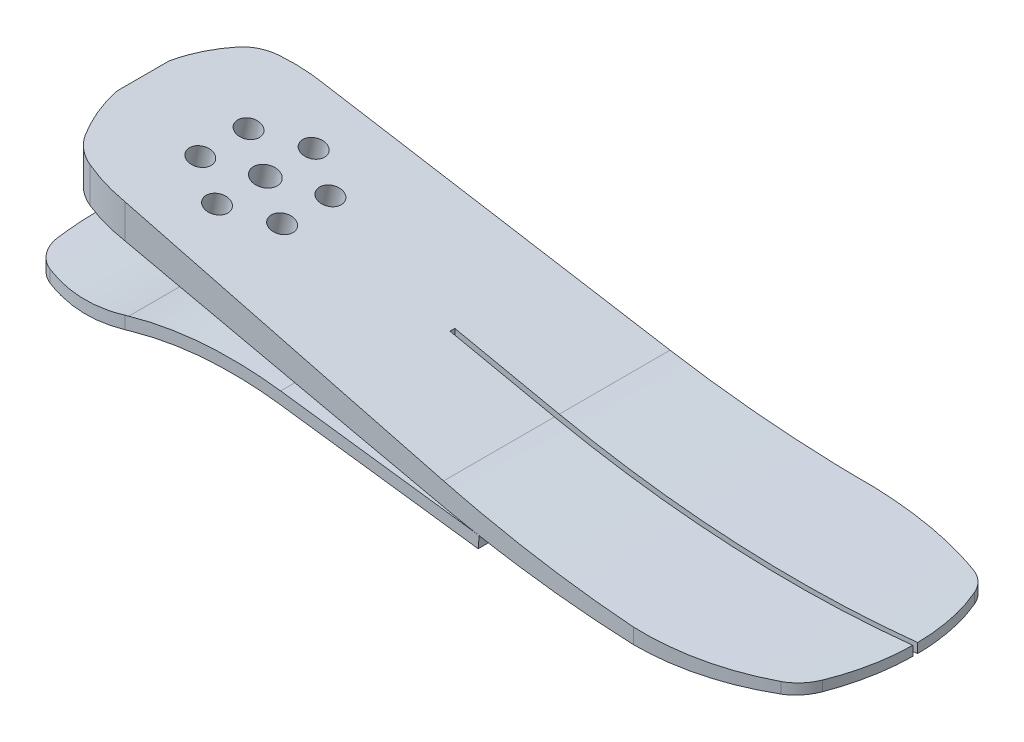
from build123d import *

# Parameters (mm, degrees)
EXTRUDE_1_DEPTH          = 80
CUT_EXTRUDE_1_DEPTH      = 80
CUT_EXTRUDE_1_DEPTH_BACK = 80
SKETCH_2_OUTSIDE_W       = 249.571
SKETCH_2_OUTSIDE_H       = 126.166
EXTRUDE_2_DEPTH          = 80
SKETCH_3_R               = 3
SKETCH_3_R_2             = 2.75
CUT_EXTRUDE_2_DEPTH      = 9
CUT_EXTRUDE_3_DEPTH      = 16
CUT_EXTRUDE_3_DEPTH_BACK = 8
SKETCH_4_W               = 130
SKETCH_4_H               = 1.2
CUT_EXTRUDE_4_DEPTH      = 80
CUT_EXTRUDE_4_DEPTH_BACK = 80
SKETCH_6_OUTSIDE_W       = 274.986
SKETCH_6_OUTSIDE_H       = 130.25
CUT_EXTRUDE_5_DEPTH      = 4
CUT_EXTRUDE_5_DEPTH_BACK = 10
SKETCH_7_W               = 148.853321433
SKETCH_7_H               = 1.2
EXTRUDE_START            = 25
EXTRUDE_3_DEPTH          = 30


with BuildPart() as part:
    # 草图1 → 凸台-拉伸1 (new body)
    with BuildSketch(Plane.XY):
        with BuildLine():
            Line((-103.404814066, 18.233058655), (0, 0))
            ThreePointArc((0, 0), (50, -4.374433176), (100, 0))
            Line((100, 0), (99.652703645, 1.969615506))
            ThreePointArc((99.652703645, 1.969615506), (50.154483855, -0.584955192), (0.955064977, 5.416442642))
            Line((0.955064977, 5.416442642), (-101.841980467, 27.096328432))
            Line((-101.841980467, 27.096328432), (-103.404814066, 18.233058655))
        make_face()
    extrude(amount=EXTRUDE_1_DEPTH)

    # 草图2 outside → 切除-拉伸1 (cut, two sides: drawn at the far end of the back side and taken through both)
    with BuildSketch(Plane(origin=(0, 0, 0), x_dir=(1, 0, 0), z_dir=(0, 1, 0)).offset(-CUT_EXTRUDE_1_DEPTH_BACK)):
        with Locations((-1.7025, -40)):
            Rectangle(SKETCH_2_OUTSIDE_W, SKETCH_2_OUTSIDE_H)
        with BuildLine():
            Line((-81.404814066, -15), (50, -10))
            ThreePointArc((50, -10), (65.598710239, -11.535484205), (80.598631148, -16.082994028))
            ThreePointArc((80.598631148, -16.082994028), (83.701137928, -18.110683802), (85.85203147, -21.129082567))
            ThreePointArc((85.85203147, -21.129082567), (90, -40), (85.85203147, -58.870917433))
            ThreePointArc((85.85203147, -58.870917433), (83.701137928, -61.889316198), (80.598631148, -63.917005972))
            ThreePointArc((80.598631148, -63.917005972), (65.598710239, -68.464515795), (50, -70))
            Line((50, -70), (-81.404814066, -65))
            ThreePointArc((-81.404814066, -65), (-86.503052151, -64.626694449), (-91.492535917, -63.514741053))
            ThreePointArc((-91.492535917, -63.514741053), (-94.787242262, -61.803307698), (-97.230517167, -59.007864662))
            ThreePointArc((-97.230517167, -59.007864662), (-102.404814066, -40), (-97.230517167, -20.992135338))
            ThreePointArc((-97.230517167, -20.992135338), (-94.787242262, -18.196692302), (-91.492535917, -16.485258947))
            ThreePointArc((-91.492535917, -16.485258947), (-86.503052151, -15.373305551), (-81.404814066, -15))
        make_face(mode=Mode.SUBTRACT)
    extrude(amount=CUT_EXTRUDE_1_DEPTH + CUT_EXTRUDE_1_DEPTH_BACK, mode=Mode.SUBTRACT)

    # 草图5 → 凸台-拉伸2 (add)
    with BuildSketch(Plane.XY):
        with BuildLine():
            Line((0.130982352, -0.692946324), (-41.136860859, 2.924444243))
            ThreePointArc((-41.136860859, 2.924444243), (-60.962244436, 2.718445526), (-80.369357278, -1.337690645))
            ThreePointArc((-80.369357278, -1.337690645), (-107.081623518, -5.831422582), (-134.01223301, -2.919195453))
            Line((-134.01223301, -2.919195453), (-134.739648073, -5.8296709))
            ThreePointArc((-134.739648073, -5.8296709), (-106.993215622, -8.83011964), (-79.471740806, -4.200256744))
            ThreePointArc((-79.471740806, -4.200256744), (-60.638237212, -0.264006371), (-41.398825562, -0.064096286))
            Line((-41.398825562, -0.064096286), (-0.130982352, -3.681486853))
            Line((-0.130982352, -3.681486853), (9.869017648, -4.558050852))
            Line((9.869017648, -4.558050852), (10.130982352, -1.569510322))
            Line((10.130982352, -1.569510322), (0.130982352, -0.692946324))
        make_face()
    extrude(amount=EXTRUDE_2_DEPTH)

    # 草图3 → 切除-拉伸2 (cut)
    with BuildSketch(Plane(origin=(1.134352673, 5.378630886, 0), x_dir=(0.9784760335424555, -0.206360489878813, 0), z_dir=(0.206360489878813, 0.9784760335424555, 0))):
        with Locations((-74.207967172, -40)):
            Circle(SKETCH_3_R)
        with Locations((-74.207967172, -28)):
            Circle(SKETCH_3_R_2)
        with Locations((-63.815662327, -34)):
            Circle(SKETCH_3_R_2)
        with Locations((-63.815662327, -46)):
            Circle(SKETCH_3_R_2)
        with Locations((-74.207967172, -52)):
            Circle(SKETCH_3_R_2)
        with Locations((-84.600272018, -46)):
            Circle(SKETCH_3_R_2)
        with Locations((-84.600272018, -34)):
            Circle(SKETCH_3_R_2)
    extrude(amount=-CUT_EXTRUDE_2_DEPTH, mode=Mode.SUBTRACT)

    # 草图4 → 切除-拉伸3 (cut, two sides: drawn at the far end of the back side and taken through both)
    with BuildSketch(Plane(origin=(0, 0, 0), x_dir=(1, 0, 0), z_dir=(0, 1, 0)).offset(-CUT_EXTRUDE_3_DEPTH_BACK)):
        with Locations((40, -40)):
            Rectangle(SKETCH_4_W, SKETCH_4_H)
    extrude(amount=CUT_EXTRUDE_3_DEPTH + CUT_EXTRUDE_3_DEPTH_BACK, mode=Mode.SUBTRACT)

    # 草图6 outside → 切除-拉伸4 (cut, two sides: drawn at the far end of the back side and taken through both)
    with BuildSketch(Plane(origin=(0, 0, 0), x_dir=(1, 0, 0), z_dir=(0, 1, 0)).offset(-CUT_EXTRUDE_4_DEPTH_BACK)):
        with Locations((-22.372, -40)):
            Rectangle(SKETCH_6_OUTSIDE_W, SKETCH_6_OUTSIDE_H)
        with BuildLine():
            Line((136.18747393, -6.720535905), (136.18747393, -73.279464095))
            Line((136.18747393, -73.279464095), (-81.404814066, -65))
            ThreePointArc((-81.404814066, -65), (-93.222494497, -63.824675343), (-104.577187887, -60.344747642))
            ThreePointArc((-104.577187887, -60.344747642), (-108.681527165, -57.165161548), (-110.63849353, -52.356247816))
            ThreePointArc((-110.63849353, -52.356247816), (-111.404814066, -40), (-110.63849353, -27.643752184))
            ThreePointArc((-110.63849353, -27.643752184), (-108.681527165, -22.834838452), (-104.577187887, -19.655252358))
            ThreePointArc((-104.577187887, -19.655252358), (-93.222494497, -16.175324657), (-81.404814066, -15))
            Line((-81.404814066, -15), (136.18747393, -6.720535905))
        make_face(mode=Mode.SUBTRACT)
    extrude(amount=CUT_EXTRUDE_4_DEPTH + CUT_EXTRUDE_4_DEPTH_BACK, mode=Mode.SUBTRACT)

    # 草图7 → 切除-拉伸5 (cut, two sides: drawn at the far end of the back side and taken through both)
    with BuildSketch(Plane(origin=(0, 0, 0), x_dir=(1, 0, 0), z_dir=(0, 1, 0)).offset(-CUT_EXTRUDE_5_DEPTH_BACK)):
        with Locations((-99.426660717, -40)):
            Rectangle(SKETCH_7_W, SKETCH_7_H)
    extrude(amount=CUT_EXTRUDE_5_DEPTH + CUT_EXTRUDE_5_DEPTH_BACK, mode=Mode.SUBTRACT)

    # 草图8 → 凸台-拉伸3 (add)
    with BuildSketch(Plane.XY.offset(EXTRUDE_START)):
        Polygon((-110.63849353, -8.872435364), (65.321019644, -3.966533563), (69.680983926, -3.134969109), (69.680983926, -3.944974028), (-110.63849353, -8.972435364), align=None)
    extrude(amount=EXTRUDE_3_DEPTH)


solid = part.part
